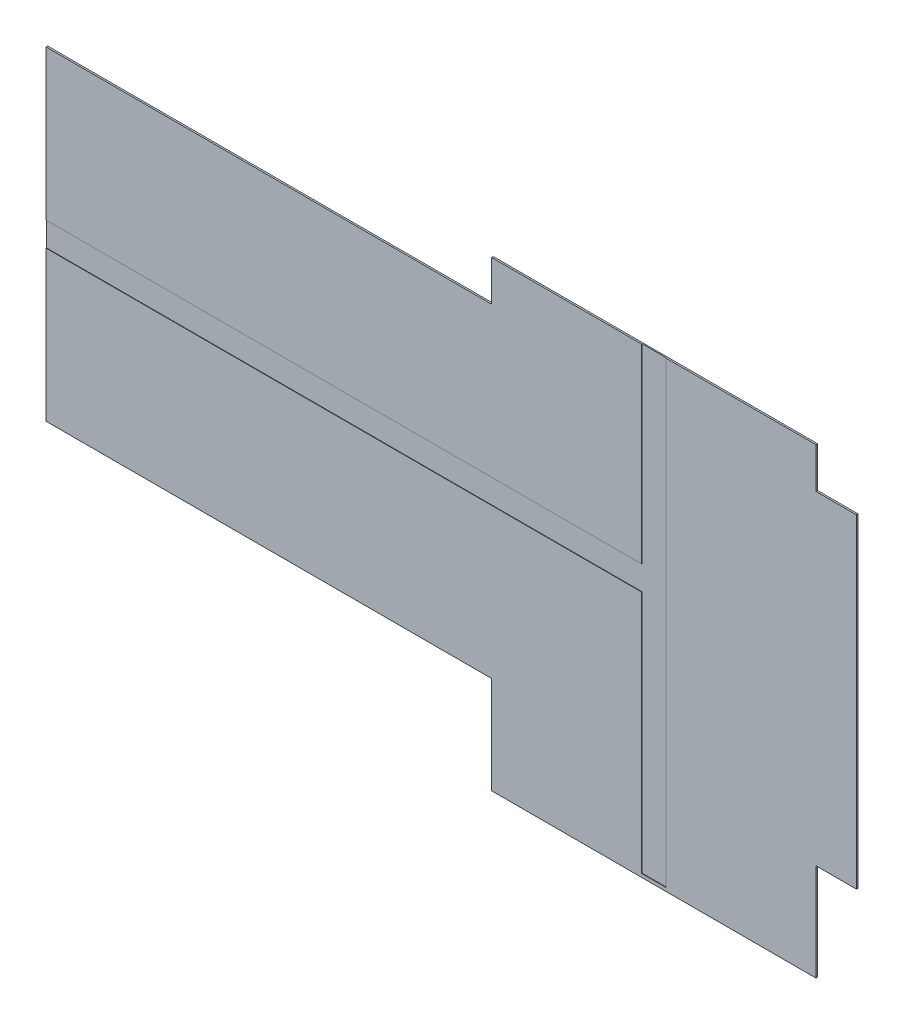
from build123d import *

# Parameters (mm, degrees)
BOSS_EXTRUDE2_DEPTH = 2
SKETCH3_W           = 735
SKETCH3_H           = 30
SKETCH3_W_2         = 30
SKETCH3_H_2         = 566.828478147
CUT_EXTRUDE1_DEPTH  = 0.5


with BuildPart() as part:
    # Sketch1 → Boss-Extrude2 (new body)
    with BuildSketch(Plane.XY):
        Polygon((381.097732077, 252.798507463), (-18.902267923, 252.798507463), (-18.902267923, 202.798507463), (-568.902267923, 202.798507463), (-568.902267923, -197.201492537), (-18.902267923, -197.201492537), (-18.902267923, -317.201492537), (381.097732077, -317.201492537), (381.097732077, -197.201492537), (431.097732077, -197.201492537), (431.097732077, 202.798507463), (381.097732077, 202.798507463), align=None)
    extrude(amount=BOSS_EXTRUDE2_DEPTH)

    # Sketch3 → Cut-Extrude1 (cut)
    with BuildSketch(Plane.XY.offset(2)):
        with Locations((-201.402267923, 2.798507463)):
            Rectangle(SKETCH3_W, SKETCH3_H)
        with Locations((181.097732077, -29.507440836)):
            Rectangle(SKETCH3_W_2, SKETCH3_H_2)
    extrude(amount=-CUT_EXTRUDE1_DEPTH, mode=Mode.SUBTRACT)


solid = part.part
